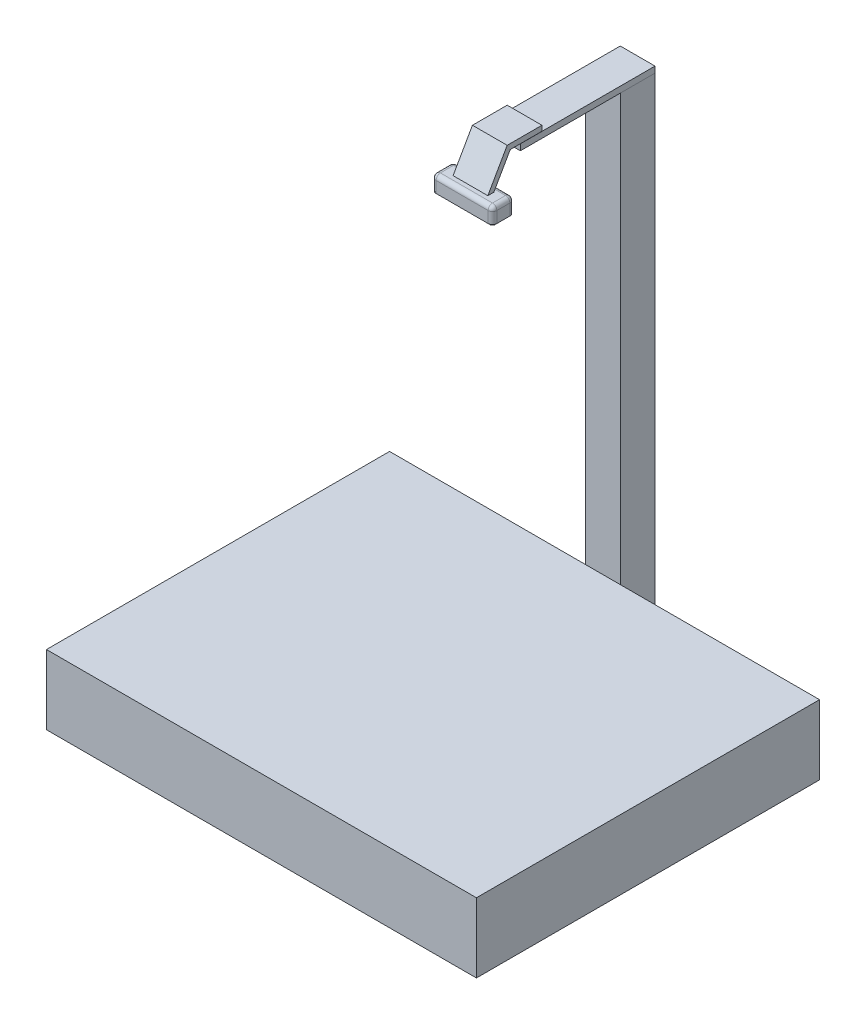
from build123d import *

# Parameters (mm, degrees)
SKETCH1_W           = 495
SKETCH1_H           = 395
BOSS_EXTRUDE1_DEPTH = 80
SKETCH2_W           = 40
SKETCH2_H           = 40
BOSS_EXTRUDE2_DEPTH = 570
SKETCH3_W           = 40.020801558
SKETCH3_H           = 155
BOSS_EXTRUDE3_DEPTH = 7
BOSS_EXTRUDE4_DEPTH = 20
BOSS_EXTRUDE5_DEPTH = 35
FILLET1_R           = 5
CHAMFER1_SIZE       = 2


with BuildPart() as part:
    # Sketch1 → Boss-Extrude1 (new body)
    with BuildSketch(Plane(origin=(0, 0, 0), x_dir=(1, 0, 0), z_dir=(0, 1, 0))):
        Rectangle(SKETCH1_W, SKETCH1_H)
    extrude(amount=BOSS_EXTRUDE1_DEPTH)

    # Sketch2 → Boss-Extrude2 (add)
    with BuildSketch(Plane(origin=(0, 0, 0), x_dir=(1, 0, 0), z_dir=(0, 1, 0))):
        with Locations((-1.923445808, 217.5)):
            Rectangle(SKETCH2_W, SKETCH2_H)
    extrude(amount=BOSS_EXTRUDE2_DEPTH)

    # Sketch3 → Boss-Extrude3 (add)
    with BuildSketch(Plane(origin=(0, 570, 0), x_dir=(1, 0, 0), z_dir=(0, 1, 0))):
        with Locations((-1.913045029, 160)):
            Rectangle(SKETCH3_W, SKETCH3_H)
    extrude(amount=BOSS_EXTRUDE3_DEPTH)


with BuildPart() as body_2:
    # Sketch4 → Boss-Extrude4 (new, symmetric)
    with BuildSketch(Plane(origin=(0, 0, 0), x_dir=(0, 0, -1), z_dir=(1, 0, 0))):
        with BuildLine():
            Line((65.408745176, 585), (105.408745176, 585))
            Line((105.408745176, 585), (105.408745176, 579))
            Line((105.408745176, 579), (68.892810257, 579))
            Line((68.892810257, 579), (50.011654683, 545.91720855))
            Line((50.011654683, 545.91720855), (53.5, 545.91720855))
            ThreePointArc((53.5, 545.91720855), (57.035533906, 544.452742456), (58.5, 540.91720855))
            Line((58.5, 540.91720855), (58.5, 525.91720855))
            Line((58.5, 525.91720855), (33.5, 525.91720855))
            Line((33.5, 525.91720855), (33.5, 540.91720855))
            ThreePointArc((33.5, 540.91720855), (34.964466094, 544.452742456), (38.5, 545.91720855))
            Line((38.5, 545.91720855), (43.103243334, 545.91720855))
            Line((43.103243334, 545.91720855), (65.408745176, 585))
        make_face()
    extrude(amount=BOSS_EXTRUDE4_DEPTH, both=True)

    # Sketch5 → Boss-Extrude5 (add, symmetric)
    with BuildSketch(Plane(origin=(0, 0, 0), x_dir=(0, 0, -1), z_dir=(1, 0, 0))):
        with BuildLine():
            Line((58.5, 525.91720855), (33.5, 525.91720855))
            Line((33.5, 525.91720855), (33.5, 540.91720855))
            ThreePointArc((33.5, 540.91720855), (34.964466094, 544.452742456), (38.5, 545.91720855))
            Line((38.5, 545.91720855), (43.103243334, 545.91720855))
            Line((43.103243334, 545.91720855), (50.011654683, 545.91720855))
            Line((50.011654683, 545.91720855), (53.5, 545.91720855))
            ThreePointArc((53.5, 545.91720855), (57.035533906, 544.452742456), (58.5, 540.91720855))
            Line((58.5, 540.91720855), (58.5, 525.91720855))
        make_face()
    extrude(amount=BOSS_EXTRUDE5_DEPTH, both=True)

    # Fillet1
    fillet1_edges = [body_2.edges().sort_by_distance(p)[0] for p in [
        (-35, 533.41720855, -58.5),
        (-35, 544.452742456, -57.035533906),
        (-35, 545.91720855, -46),
        (-35, 544.452742456, -34.964466094),
        (-35, 533.41720855, -33.5),
        (35, 533.41720855, -58.5),
        (35, 544.452742456, -57.035533906),
        (35, 545.91720855, -46),
        (35, 544.452742456, -34.964466094),
        (35, 533.41720855, -33.5),
    ]]
    fillet(fillet1_edges, radius=FILLET1_R)

    # Chamfer1
    chamfer1_edges = [body_2.edges().sort_by_distance(p)[0] for p in [
        (0, 525.91720855, -33.5),
        (-35, 525.91720855, -46),
        (0, 525.91720855, -58.5),
        (35, 525.91720855, -46),
        (33.535533906, 525.91720855, -57.035533906),
        (-33.535533906, 525.91720855, -57.035533906),
        (33.535533906, 525.91720855, -34.964466094),
        (-33.535533906, 525.91720855, -34.964466094),
    ]]
    chamfer(chamfer1_edges, length=CHAMFER1_SIZE)


solid = Compound([part.part, body_2.part])
